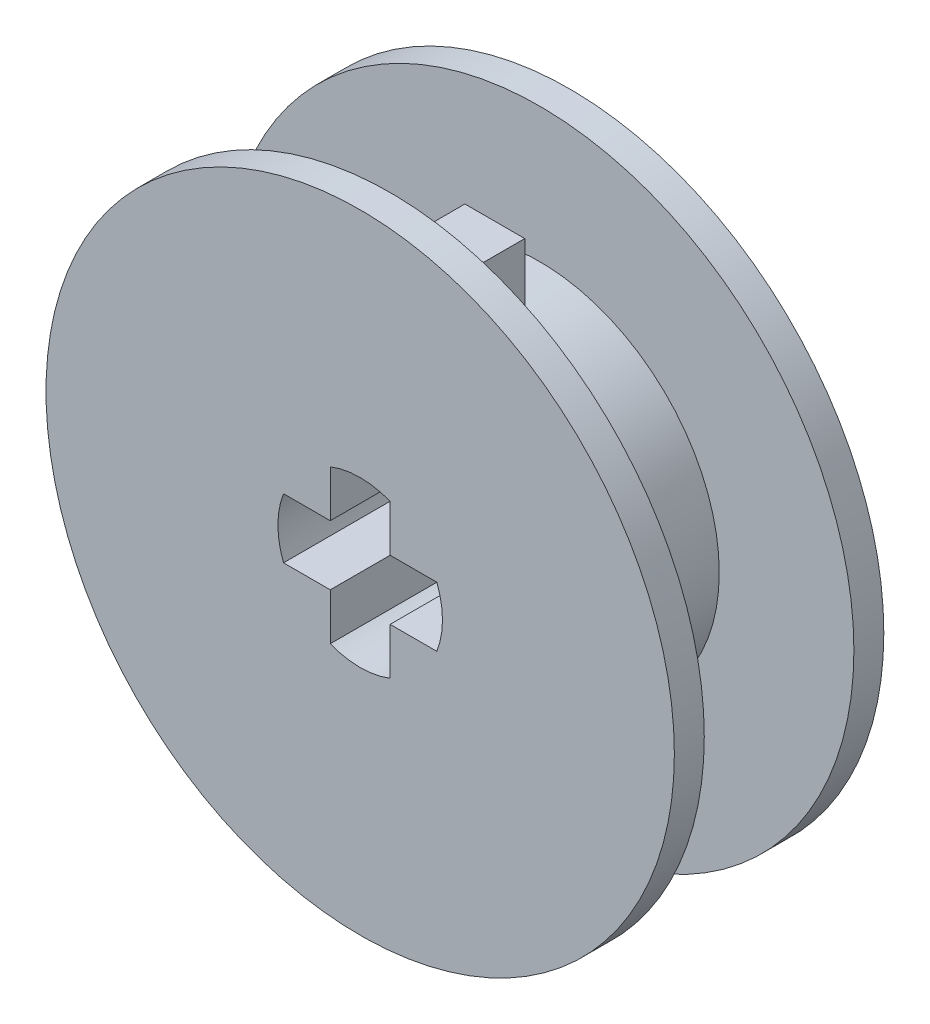
from build123d import *

# Parameters (mm, degrees)
ESQUISSE1_R        = 6
BOSS_EXTRU_1_DEPTH = 2.5
ESQUISSE2_R        = 10.5
BOSS_EXTRU_4_DEPTH = 1
ESQUISSE3_W        = 2
ESQUISSE3_H        = 2
BOSS_EXTRU_5_DEPTH = 1


with BuildPart() as part:
    # Esquisse1 → Boss.-Extru.1 (new body)
    with BuildSketch(Plane.XY):
        Circle(ESQUISSE1_R)
        with BuildLine():
            Line((-2.561737691, 1), (-1, 1))
            Line((-1, 1), (-1, 2.561737691))
            ThreePointArc((-1, 2.561737691), (0, 2.75), (1, 2.561737691))
            Line((1, 2.561737691), (1, 1))
            Line((1, 1), (2.561737691, 1))
            ThreePointArc((2.561737691, 1), (2.75, 0), (2.561737691, -1))
            Line((2.561737691, -1), (1, -1))
            Line((1, -1), (1, -2.561737691))
            ThreePointArc((1, -2.561737691), (0, -2.75), (-1, -2.561737691))
            Line((-1, -2.561737691), (-1, -1))
            Line((-1, -1), (-2.561737691, -1))
            ThreePointArc((-2.561737691, -1), (-2.75, 0), (-2.561737691, 1))
        make_face(mode=Mode.SUBTRACT)
    boss_extru_1 = extrude(amount=BOSS_EXTRU_1_DEPTH)

    # Esquisse2 → Boss.-Extru.4 (add)
    with BuildSketch(Plane.XY.offset(2.5)):
        Circle(ESQUISSE2_R)
        with BuildLine():
            Line((-1, 2.561737691), (-1, 1))
            Line((-1, 1), (-2.561737691, 1))
            ThreePointArc((-2.561737691, 1), (-2.75, 0), (-2.561737691, -1))
            Line((-2.561737691, -1), (-1, -1))
            Line((-1, -1), (-1, -2.561737691))
            ThreePointArc((-1, -2.561737691), (0, -2.75), (1, -2.561737691))
            Line((1, -2.561737691), (1, -1))
            Line((1, -1), (2.561737691, -1))
            ThreePointArc((2.561737691, -1), (2.75, 0), (2.561737691, 1))
            Line((2.561737691, 1), (1, 1))
            Line((1, 1), (1, 2.561737691))
            ThreePointArc((1, 2.561737691), (0, 2.75), (-1, 2.561737691))
        make_face(mode=Mode.SUBTRACT)
    boss_extru_4 = extrude(amount=BOSS_EXTRU_4_DEPTH)

    # Esquisse3 → Boss.-Extru.5 (add)
    with BuildSketch(Plane(origin=(0, 0, 0), x_dir=(-1, 0, 0), z_dir=(0, 0, -1))):
        with Locations((0, 6.916079783)):
            Rectangle(ESQUISSE3_W, ESQUISSE3_H)
    boss_extru_5 = extrude(amount=-BOSS_EXTRU_5_DEPTH)


with BuildPart() as sym_trie1_1:
    # Symétrie1: Boss.-Extru.1, Boss.-Extru.4, Boss.-Extru.5 across Front Plane
    add(boss_extru_1.mirror(Plane.XY))
    add(boss_extru_4.mirror(Plane.XY))
    add(boss_extru_5.mirror(Plane.XY))


with BuildPart() as part_1:
    add(part.part)

    # Symétrie1 united with what the copies to: union Symétrie1_1
    add(sym_trie1_1.part)


solid = part_1.part
